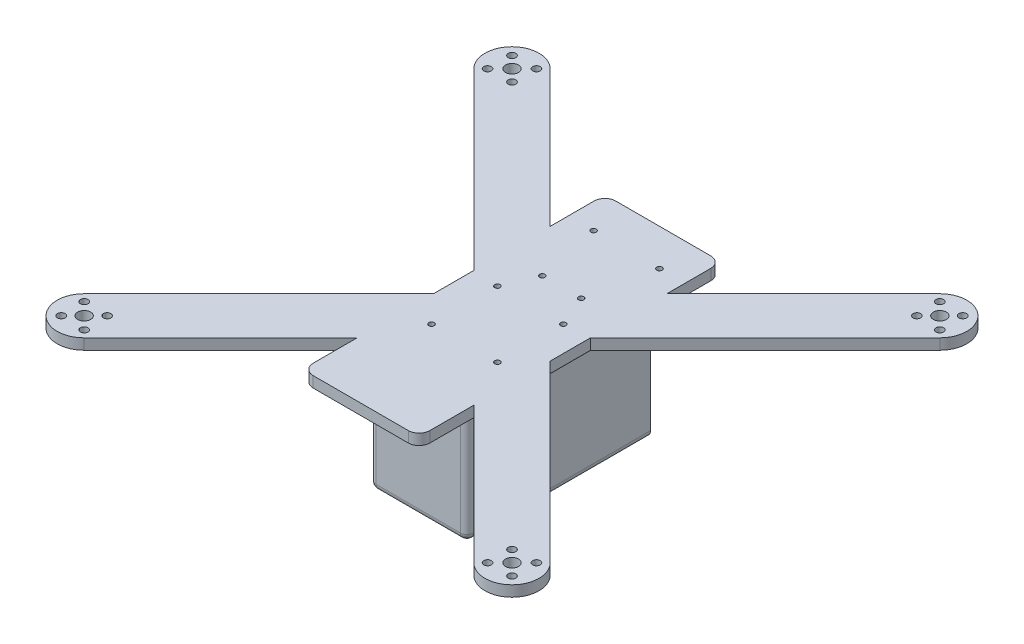
from build123d import *

# Parameters (mm, degrees)
BOSS_EXTRUDE1_DEPTH       = 5
CUT_EXTRUDE1_REACH        = 159.757
SKETCH3_R                 = 3
SKETCH3_R_2               = 1.75
MIRROR2_COPY_1_REACH      = 159.757
MIRROR2_COPY_1_SKETCH_R   = 3
MIRROR2_COPY_1_SKETCH_R_2 = 1.75
M3X0_5_TAPPED_HOLE1_D     = 2.5
BOSS_EXTRUDE2_DEPTH       = 47
SKETCH7_W                 = 45
SKETCH7_H                 = 85
BOSS_EXTRUDE3_DEPTH       = 5
FILLET1_R                 = 5
FILLET2_R                 = 3


with BuildPart() as part:
    # Sketch2 → Boss-Extrude1 (new body)
    with BuildSketch(Plane(origin=(0, 0, 0), x_dir=(1, 0, 0), z_dir=(0, 1, 0))):
        with BuildLine():
            Line((-27, 70), (27, 70))
            Line((27, 70), (27, 44.67766953))
            Line((27, 44.67766953), (90.156114601, 107.833784131))
            ThreePointArc((90.156114601, 107.833784131), (107.833784131, 107.833784131), (107.833784131, 90.156114601))
            Line((107.833784131, 90.156114601), (27, 9.32233047))
            Line((27, 9.32233047), (27, -9.32233047))
            Line((27, -9.32233047), (107.833784131, -90.156114601))
            ThreePointArc((107.833784131, -90.156114601), (107.833784131, -107.833784131), (90.156114601, -107.833784131))
            Line((90.156114601, -107.833784131), (27, -44.67766953))
            Line((27, -44.67766953), (27, -70))
            Line((27, -70), (-27, -70))
            Line((-27, -70), (-27, -44.67766953))
            Line((-27, -44.67766953), (-90.156114601, -107.833784131))
            ThreePointArc((-90.156114601, -107.833784131), (-107.833784131, -107.833784131), (-107.833784131, -90.156114601))
            Line((-107.833784131, -90.156114601), (-27, -9.32233047))
            Line((-27, -9.32233047), (-27, 9.32233047))
            Line((-27, 9.32233047), (-107.833784131, 90.156114601))
            ThreePointArc((-107.833784131, 90.156114601), (-107.833784131, 107.833784131), (-90.156114601, 107.833784131))
            Line((-90.156114601, 107.833784131), (-27, 44.67766953))
            Line((-27, 44.67766953), (-27, 70))
        make_face()
    extrude(amount=BOSS_EXTRUDE1_DEPTH)

    # Sketch3 → Cut-Extrude1 (cut, up to next)
    with BuildSketch(Plane(origin=(0, 5, 0), x_dir=(1, 0, 0), z_dir=(0, 1, 0)), mode=Mode.PRIVATE) as cut_extrude1_sk1:
        with Locations(Location((-98.994949366, -98.994949366, 0), (0, 0, 270))):
            Circle(SKETCH3_R)
    cut_extrude1_tool1 = extrude(cut_extrude1_sk1.sketch, amount=-CUT_EXTRUDE1_REACH, mode=Mode.PRIVATE) & part.part
    # Sketch3 → Cut-Extrude1 (cut, up to next)
    with BuildSketch(Plane(origin=(0, 5, 0), x_dir=(1, 0, 0), z_dir=(0, 1, 0)), mode=Mode.PRIVATE) as cut_extrude1_sk2:
        with Locations(Location((-104.298250225, -104.298250225, 0), (0, 0, 270))):
            Circle(SKETCH3_R_2)
    cut_extrude1_tool2 = extrude(cut_extrude1_sk2.sketch, amount=-CUT_EXTRUDE1_REACH, mode=Mode.PRIVATE) & part.part
    # Sketch3 → Cut-Extrude1 (cut, up to next)
    with BuildSketch(Plane(origin=(0, 5, 0), x_dir=(1, 0, 0), z_dir=(0, 1, 0)), mode=Mode.PRIVATE) as cut_extrude1_sk3:
        with Locations(Location((-93.338095117, -104.651803616, 0), (0, 0, 270))):
            Circle(SKETCH3_R_2)
    cut_extrude1_tool3 = extrude(cut_extrude1_sk3.sketch, amount=-CUT_EXTRUDE1_REACH, mode=Mode.PRIVATE) & part.part
    # Sketch3 → Cut-Extrude1 (cut, up to next)
    with BuildSketch(Plane(origin=(0, 5, 0), x_dir=(1, 0, 0), z_dir=(0, 1, 0)), mode=Mode.PRIVATE) as cut_extrude1_sk4:
        with Locations(Location((-104.651803616, -93.338095117, 0), (0, 0, 270))):
            Circle(SKETCH3_R_2)
    cut_extrude1_tool4 = extrude(cut_extrude1_sk4.sketch, amount=-CUT_EXTRUDE1_REACH, mode=Mode.PRIVATE) & part.part
    # Sketch3 → Cut-Extrude1 (cut, up to next)
    with BuildSketch(Plane(origin=(0, 5, 0), x_dir=(1, 0, 0), z_dir=(0, 1, 0)), mode=Mode.PRIVATE) as cut_extrude1_sk5:
        with Locations(Location((-93.691648507, -93.691648507, 0), (0, 0, 270))):
            Circle(SKETCH3_R_2)
    cut_extrude1_tool5 = extrude(cut_extrude1_sk5.sketch, amount=-CUT_EXTRUDE1_REACH, mode=Mode.PRIVATE) & part.part
    cut_extrude1_1 = cut_extrude1_tool1.solids().sort_by_distance((-98.994949, 5, 98.994949))[0]
    add(cut_extrude1_1, mode=Mode.SUBTRACT)
    cut_extrude1_2 = cut_extrude1_tool2.solids().sort_by_distance((-104.29825, 5, 104.29825))[0]
    add(cut_extrude1_2, mode=Mode.SUBTRACT)
    cut_extrude1_3 = cut_extrude1_tool3.solids().sort_by_distance((-93.338095, 5, 104.651804))[0]
    add(cut_extrude1_3, mode=Mode.SUBTRACT)
    cut_extrude1_4 = cut_extrude1_tool4.solids().sort_by_distance((-104.651804, 5, 93.338095))[0]
    add(cut_extrude1_4, mode=Mode.SUBTRACT)
    cut_extrude1_5 = cut_extrude1_tool5.solids().sort_by_distance((-93.691649, 5, 93.691649))[0]
    add(cut_extrude1_5, mode=Mode.SUBTRACT)
    cut_extrude1 = cut_extrude1_1 + cut_extrude1_2 + cut_extrude1_3 + cut_extrude1_4 + cut_extrude1_5  # Cut-Extrude1 as one shape, for the pattern or mirror that repeats it

    # Mirror1: Cut-Extrude1 across plane
    add(cut_extrude1.mirror(Plane(origin=(0, 0, 0), x_dir=(0, 0, 1), z_dir=(1, 0, 0))), mode=Mode.SUBTRACT)

    # Mirror2: Cut-Extrude1 across plane
    add(cut_extrude1.mirror(Plane.XY), mode=Mode.SUBTRACT)

    # Mirror2 copy 1 sketch → Mirror2 copy 1 (cut, up to next)
    with BuildSketch(Plane(origin=(0, 5, 0), x_dir=(-1, 0, 0), z_dir=(0, 1, 0)), mode=Mode.PRIVATE) as mirror2_copy_1_sk1:
        with Locations(Location((-98.994949366, -98.994949366, 0), (0, 0, 270))):
            Circle(MIRROR2_COPY_1_SKETCH_R)
    mirror2_copy_1_tool1 = extrude(mirror2_copy_1_sk1.sketch, amount=-MIRROR2_COPY_1_REACH, mode=Mode.PRIVATE) & part.part
    # Mirror2 copy 1 sketch → Mirror2 copy 1 (cut, up to next)
    with BuildSketch(Plane(origin=(0, 5, 0), x_dir=(-1, 0, 0), z_dir=(0, 1, 0)), mode=Mode.PRIVATE) as mirror2_copy_1_sk2:
        with Locations(Location((-104.298250225, -104.298250225, 0), (0, 0, 270))):
            Circle(MIRROR2_COPY_1_SKETCH_R_2)
    mirror2_copy_1_tool2 = extrude(mirror2_copy_1_sk2.sketch, amount=-MIRROR2_COPY_1_REACH, mode=Mode.PRIVATE) & part.part
    # Mirror2 copy 1 sketch → Mirror2 copy 1 (cut, up to next)
    with BuildSketch(Plane(origin=(0, 5, 0), x_dir=(-1, 0, 0), z_dir=(0, 1, 0)), mode=Mode.PRIVATE) as mirror2_copy_1_sk3:
        with Locations(Location((-93.338095117, -104.651803616, 0), (0, 0, 270))):
            Circle(MIRROR2_COPY_1_SKETCH_R_2)
    mirror2_copy_1_tool3 = extrude(mirror2_copy_1_sk3.sketch, amount=-MIRROR2_COPY_1_REACH, mode=Mode.PRIVATE) & part.part
    # Mirror2 copy 1 sketch → Mirror2 copy 1 (cut, up to next)
    with BuildSketch(Plane(origin=(0, 5, 0), x_dir=(-1, 0, 0), z_dir=(0, 1, 0)), mode=Mode.PRIVATE) as mirror2_copy_1_sk4:
        with Locations(Location((-104.651803616, -93.338095117, 0), (0, 0, 270))):
            Circle(MIRROR2_COPY_1_SKETCH_R_2)
    mirror2_copy_1_tool4 = extrude(mirror2_copy_1_sk4.sketch, amount=-MIRROR2_COPY_1_REACH, mode=Mode.PRIVATE) & part.part
    # Mirror2 copy 1 sketch → Mirror2 copy 1 (cut, up to next)
    with BuildSketch(Plane(origin=(0, 5, 0), x_dir=(-1, 0, 0), z_dir=(0, 1, 0)), mode=Mode.PRIVATE) as mirror2_copy_1_sk5:
        with Locations(Location((-93.691648507, -93.691648507, 0), (0, 0, 270))):
            Circle(MIRROR2_COPY_1_SKETCH_R_2)
    mirror2_copy_1_tool5 = extrude(mirror2_copy_1_sk5.sketch, amount=-MIRROR2_COPY_1_REACH, mode=Mode.PRIVATE) & part.part
    add(mirror2_copy_1_tool1.solids().sort_by_distance((98.994949, 5, -98.994949))[0], mode=Mode.SUBTRACT)
    add(mirror2_copy_1_tool2.solids().sort_by_distance((104.29825, 5, -104.29825))[0], mode=Mode.SUBTRACT)
    add(mirror2_copy_1_tool3.solids().sort_by_distance((93.338095, 5, -104.651804))[0], mode=Mode.SUBTRACT)
    add(mirror2_copy_1_tool4.solids().sort_by_distance((104.651804, 5, -93.338095))[0], mode=Mode.SUBTRACT)
    add(mirror2_copy_1_tool5.solids().sort_by_distance((93.691649, 5, -93.691649))[0], mode=Mode.SUBTRACT)

    # M3x0.5 Tapped Hole1 (through all)
    with Locations(Plane(origin=(0, 5, 0), x_dir=(1, 0, 0), z_dir=(0, 1, 0))):
        with Locations((-15.25, -22), (15.25, -22), (-15.25, 8.5), (15.25, 8.5), (-9, 23), (9, 23), (-15.25, 53), (15.25, 53)):
            Hole(M3X0_5_TAPPED_HOLE1_D / 2)

    # Sketch6 → Boss-Extrude2 (add)
    with BuildSketch(Plane.XZ):
        Polygon((-15.881026332, -40), (-20.881026332, -40), (-20.881026332, 45), (24.118973668, 45), (24.118973668, -40), (19.118973668, -40), (19.118973668, 40), (-15.881026332, 40), align=None)
    extrude(amount=BOSS_EXTRUDE2_DEPTH)

    # Sketch7 → Boss-Extrude3 (add)
    with BuildSketch(Plane.XZ.offset(47)):
        with Locations((1.618973668, 2.5)):
            Rectangle(SKETCH7_W, SKETCH7_H)
    extrude(amount=BOSS_EXTRUDE3_DEPTH)

    # Fillet1
    fillet1_edges = [part.edges().sort_by_distance(p)[0] for p in [
        (27, 2.5, 70),
        (-27, 2.5, 70),
        (-27, 2.5, -70),
        (27, 2.5, -70),
    ]]
    fillet(fillet1_edges, radius=FILLET1_R)

    # Fillet2
    fillet2_edges = [part.edges().sort_by_distance(p)[0] for p in [
        (-20.881026332, 0, 2.5),
        (-20.881026332, -26, 45),
        (24.118973668, 0, 2.5),
        (1.618973668, 0, 45),
        (24.118973668, -26, 45),
        (-20.881026332, -52, 2.5),
        (24.118973668, -52, 2.5),
        (1.618973668, -52, 45),
    ]]
    fillet(fillet2_edges, radius=FILLET2_R)


solid = part.part
